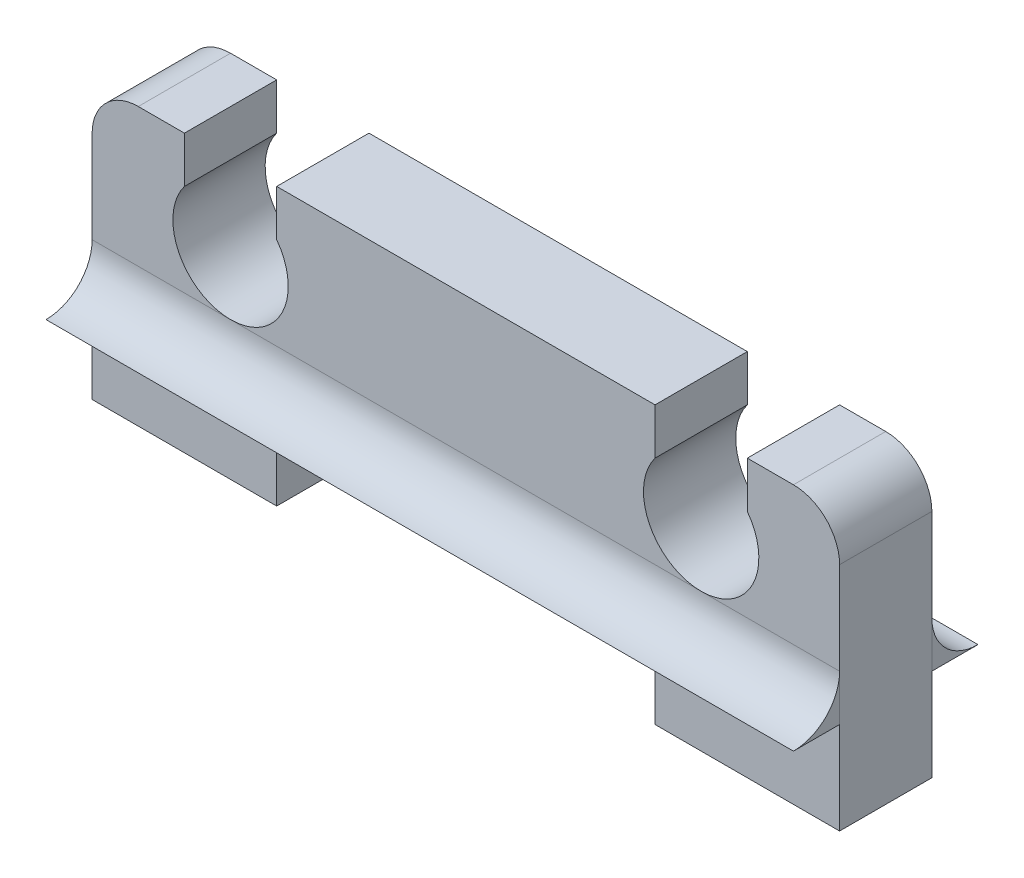
from build123d import *

# Parameters (mm, degrees)
BOSS_EXTRUDE1_DEPTH   = 2
BOSS_EXTRUDE2_DEPTH   = 16.2
BOSS_EXTRUDE2_2_DEPTH = 16.2
SKETCH3_W             = 4
SKETCH3_H             = 2
CUT_EXTRUDE1_DEPTH    = 19.315021158


with BuildPart() as part:
    # Sketch1 → Boss-Extrude1 (new body)
    with BuildSketch(Plane.XY):
        with BuildLine():
            Line((4, 8), (12.2, 8))
            Line((12.2, 8), (12.2, 7))
            ThreePointArc((12.2, 7), (13.2, 5), (14.2, 7))
            Line((14.2, 7), (14.2, 8))
            Line((14.2, 8), (15.2, 8))
            ThreePointArc((15.2, 8), (15.907106781, 7.707106781), (16.2, 7))
            Line((16.2, 7), (16.2, 0))
            Line((16.2, 0), (12.2, 0))
            Line((12.2, 0), (12.2, 4))
            Line((12.2, 4), (4, 4))
            Line((4, 4), (4, 0))
            Line((4, 0), (0, 0))
            Line((0, 0), (0, 7))
            ThreePointArc((0, 7), (0.292893219, 7.707106781), (1, 8))
            Line((1, 8), (2, 8))
            Line((2, 8), (2, 7))
            ThreePointArc((2, 7), (3, 5), (4, 7))
            Line((4, 7), (4, 8))
        make_face()
    extrude(amount=BOSS_EXTRUDE1_DEPTH)

    # Sketch3 → Cut-Extrude1 (cut, through all)
    with BuildSketch(Plane.XY.offset(2)):
        with Locations((2, 1)):
            Rectangle(SKETCH3_W, SKETCH3_H)
        with Locations((14.2, 1)):
            Rectangle(SKETCH3_W, SKETCH3_H)
    extrude(amount=-CUT_EXTRUDE1_DEPTH, mode=Mode.SUBTRACT)


with BuildPart() as body_2:
    # Sketch2 → Boss-Extrude2 (new body)
    with BuildSketch(Plane.ZY):
        with BuildLine():
            Line((2, 4), (2, 5))
            ThreePointArc((2, 5), (2.292893219, 4.292893219), (3, 4))
            Line((3, 4), (2, 4))
        make_face()
    extrude(amount=-BOSS_EXTRUDE2_DEPTH)


with BuildPart() as body_3:
    # Sketch2 → Boss-Extrude2 2 (new body)
    with BuildSketch(Plane.ZY):
        with BuildLine():
            Line((0, 4), (-1, 4))
            ThreePointArc((-1, 4), (-0.292893219, 4.292893219), (0, 5))
            Line((0, 5), (0, 4))
        make_face()
    extrude(amount=-BOSS_EXTRUDE2_2_DEPTH)


solid = Compound([part.part, body_2.part, body_3.part])
